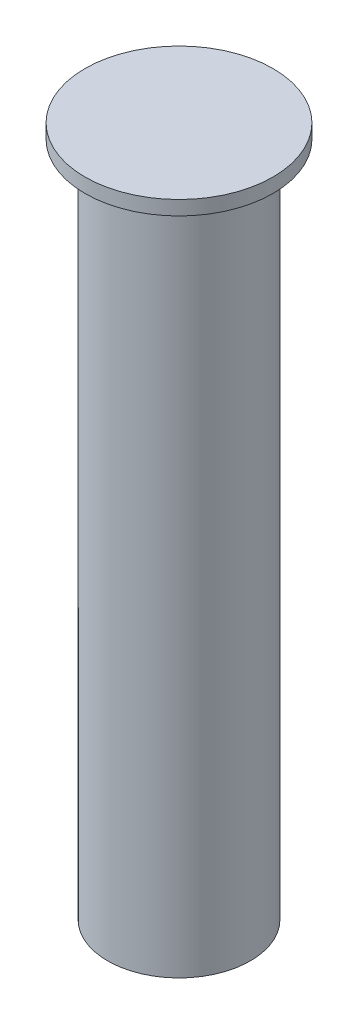
from build123d import *


with BuildPart() as part:
    # Szkic1 → Obrót1 (revolve)
    with BuildSketch(Plane.XY):
        Polygon((0, 0), (-19.75, 0), (-19.75, -3), (-15, -3), (-15, -145), (0, -145), align=None)
    revolve(axis=Axis((0, 0, 0), (0, -1, 0)))


solid = part.part
